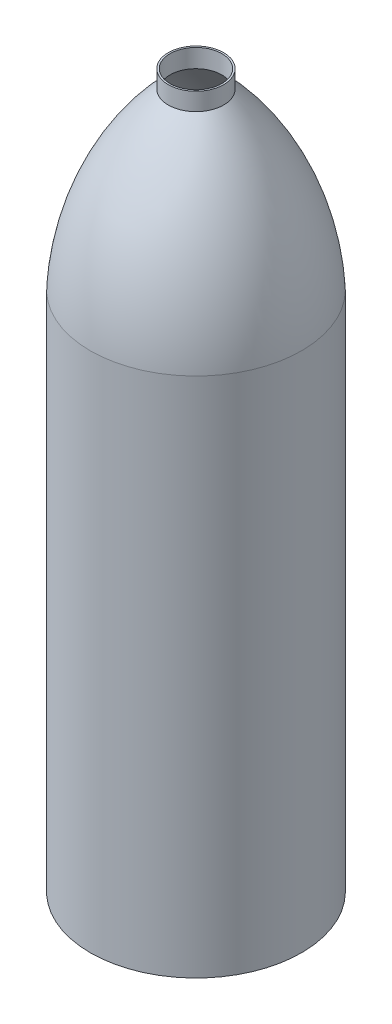
from build123d import *


with BuildPart() as part:
    # Sketch8 → Revolve1 (revolve)
    with BuildSketch(Plane.XY, mode=Mode.PRIVATE) as revolve1_sk:
        with BuildLine():
            Line((0, -44.157655741), (-60, -44.157655741))
            Line((-60, -44.157655741), (-60, 255.842344259))
            ThreePointArc((-60, 255.842344259), (-46.807103103, 310.030540655), (-15, 355.842344259))
            Line((-15, 355.842344259), (-15, 365.473388744))
            Line((-15, 365.473388744), (-15, 366.473388744))
            Line((-15, 366.473388744), (-16, 366.473388744))
            Line((-16, 366.473388744), (-16, 356.258998247))
            ThreePointArc((-16, 356.258998247), (-47.810277996, 310.237725941), (-61, 255.869697429))
            Line((-61, 255.869697429), (-61, -45.157655741))
            Line((-61, -45.157655741), (0, -45.157655741))
            Line((0, -45.157655741), (0, -44.157655741))
        make_face()
    revolve(revolve1_sk.sketch.rotate(Axis((0, 434.739798995, 0), (0, -1, 0)), 270), axis=Axis((0, 434.739798995, 0), (0, -1, 0)))


solid = part.part
